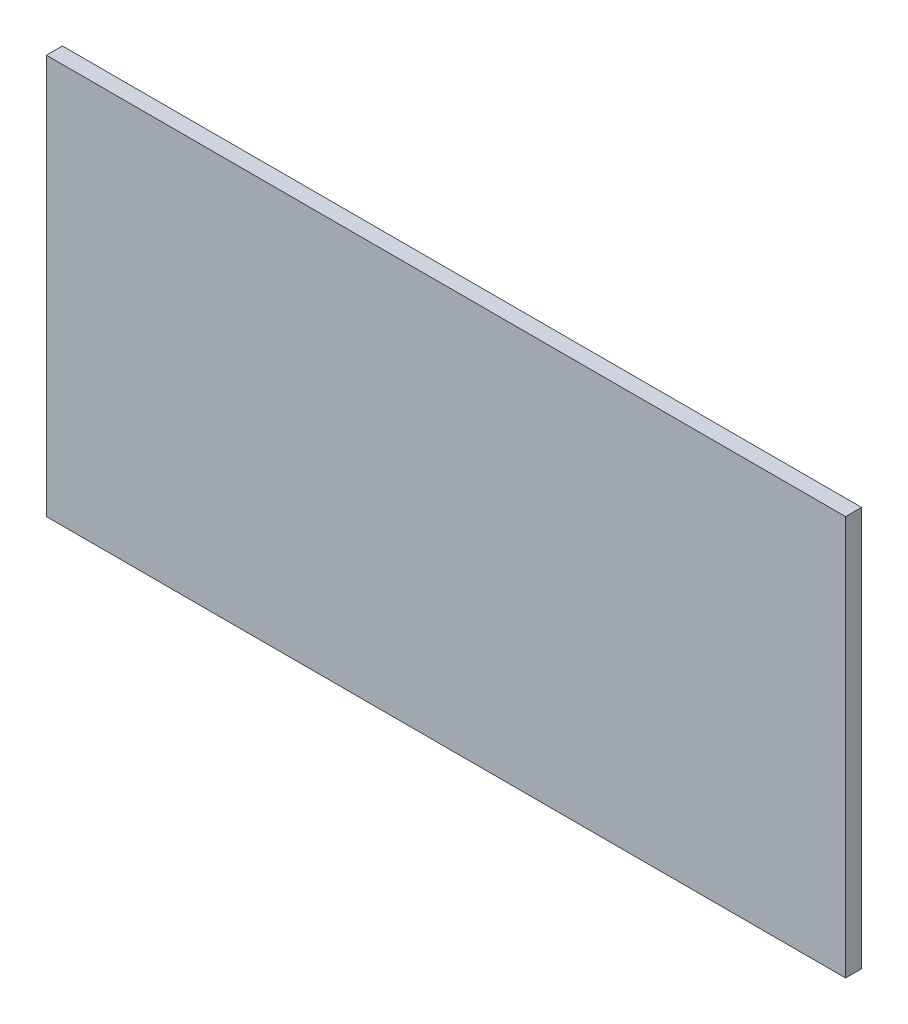
from build123d import *

# Parameters (mm, degrees)
SKETCH_1_W      = 200
SKETCH_1_H      = 100
EXTRUDE_1_DEPTH = 4


with BuildPart() as part:
    # Эскиз1 → Бобышка-Вытянуть1 (new body)
    with BuildSketch(Plane.XY):
        Rectangle(SKETCH_1_W, SKETCH_1_H)
    extrude(amount=EXTRUDE_1_DEPTH)


solid = part.part
